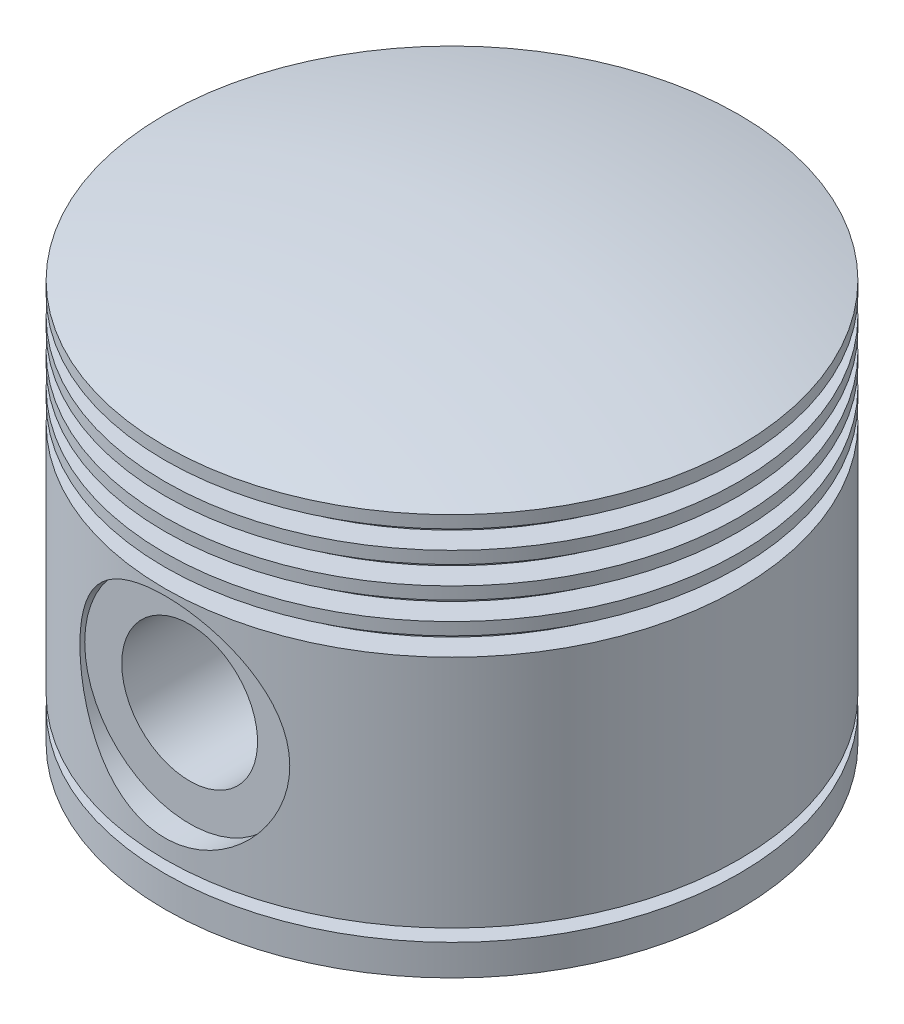
from build123d import *

# Parameters (mm, degrees)
BOSS_EXTRUDE2_REACH     = 123.636
BOSS_EXTRUDE2_START     = -25
SKETCH2_R               = 18
CUT_EXTRUDE1_REACH      = 141.136
CUT_EXTRUDE1_END_RADIUS = 46.5
CUT_EXTRUDE1_START      = -42.5
SKETCH2_3_R             = 17
SKETCH2_4_R             = 11
CUT_EXTRUDE2_DEPTH      = 90


with BuildPart() as part:
    # Sketch1 → Revolve1 (revolve)
    with BuildSketch(Plane.XY):
        with BuildLine():
            Line((37, 0), (46.5, 0))
            Line((46.5, 0), (46.5, 5))
            Line((46.5, 5), (42.5, 5))
            Line((42.5, 5), (42.5, 7))
            Line((42.5, 7), (46.5, 7))
            Line((46.5, 7), (46.5, 45))
            Line((46.5, 45), (42.5, 45))
            Line((42.5, 45), (42.5, 48))
            Line((42.5, 48), (46.5, 48))
            Line((46.5, 48), (46.5, 50))
            Line((46.5, 50), (42.5, 50))
            Line((42.5, 50), (42.5, 53))
            Line((42.5, 53), (46.5, 53))
            Line((46.5, 53), (46.5, 55))
            Line((46.5, 55), (42.5, 55))
            Line((42.5, 55), (42.5, 58))
            Line((42.5, 58), (46.5, 58))
            Line((46.5, 58), (46.5, 60))
            Line((46.5, 60), (42.5, 60))
            Line((42.5, 60), (42.5, 63))
            Line((42.5, 63), (46.5, 63))
            Line((46.5, 63), (46.5, 65))
            ThreePointArc((46.5, 65), (23.430752148, 69.351520264), (0, 70.809525357))
            Line((0, 70.809525357), (0, 65))
            Line((0, 65), (37, 65))
            Line((37, 65), (37, 0))
        make_face()
    revolve(axis=Axis((0, 65, 0), (0, 1, 0)))

    # Sketch2 → Boss-Extrude2 (add, up to next)
    with BuildSketch(Plane.XY.offset(BOSS_EXTRUDE2_START), mode=Mode.PRIVATE) as boss_extrude2_sk1:
        with Locations((0, 27)):
            Circle(SKETCH2_R)
    boss_extrude2_tool1 = extrude(boss_extrude2_sk1.sketch, amount=-BOSS_EXTRUDE2_REACH, mode=Mode.PRIVATE) - part.part
    boss_extrude2 = boss_extrude2_tool1.solids().sort_by_distance((0, 27, -25))[0]
    add(boss_extrude2)

    # Cut-Extrude1: up to this cylinder (the profile starts inside it)
    cut_extrude1_end = Plane(origin=(0, 27, 0), z_dir=(0, -1, 0)) * Cylinder(CUT_EXTRUDE1_END_RADIUS, 376.272, mode=Mode.PRIVATE)
    # Sketch2<3> → Cut-Extrude1 (cut, up to the surface)
    with BuildSketch(Plane.XY.offset(CUT_EXTRUDE1_START), mode=Mode.PRIVATE) as cut_extrude1_sk1:
        with Locations((0, 27)):
            Circle(SKETCH2_3_R)
    cut_extrude1_tool1 = extrude(cut_extrude1_sk1.sketch, amount=-CUT_EXTRUDE1_REACH, mode=Mode.PRIVATE) & cut_extrude1_end
    cut_extrude1 = cut_extrude1_tool1.solids().sort_by_distance((0, 27, -42.5))[0]
    add(cut_extrude1, mode=Mode.SUBTRACT)

    # Sketch2<4> → Cut-Extrude2 (cut)
    with BuildSketch(Plane.XY):
        with Locations((0, 27)):
            Circle(SKETCH2_4_R)
    cut_extrude2 = extrude(amount=-CUT_EXTRUDE2_DEPTH, mode=Mode.SUBTRACT)

    # Mirror1: Boss-Extrude2, Cut-Extrude1, Cut-Extrude2 across plane
    add(boss_extrude2.mirror(Plane.XY))
    add(cut_extrude1.mirror(Plane.XY), mode=Mode.SUBTRACT)
    add(cut_extrude2.mirror(Plane.XY), mode=Mode.SUBTRACT)


solid = part.part
